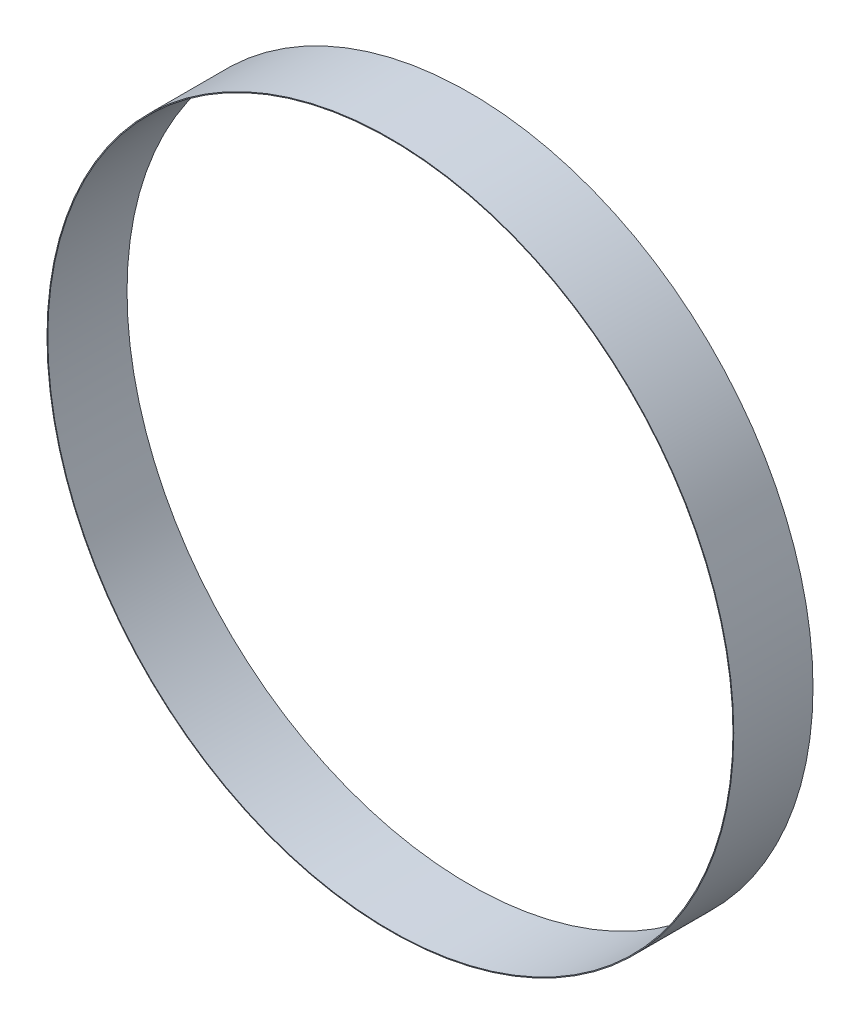
from build123d import *

# Parameters (mm, degrees)
SKETCH1_R           = 1300
SKETCH1_R_2         = 1297
EXTRUDE_THIN1_DEPTH = 150


with BuildPart() as part:
    # Sketch1 → Extrude-Thin1 (new, symmetric)
    with BuildSketch(Plane.XY):
        Circle(SKETCH1_R)
        Circle(SKETCH1_R_2, mode=Mode.SUBTRACT)
    extrude(amount=EXTRUDE_THIN1_DEPTH, both=True)


solid = part.part
